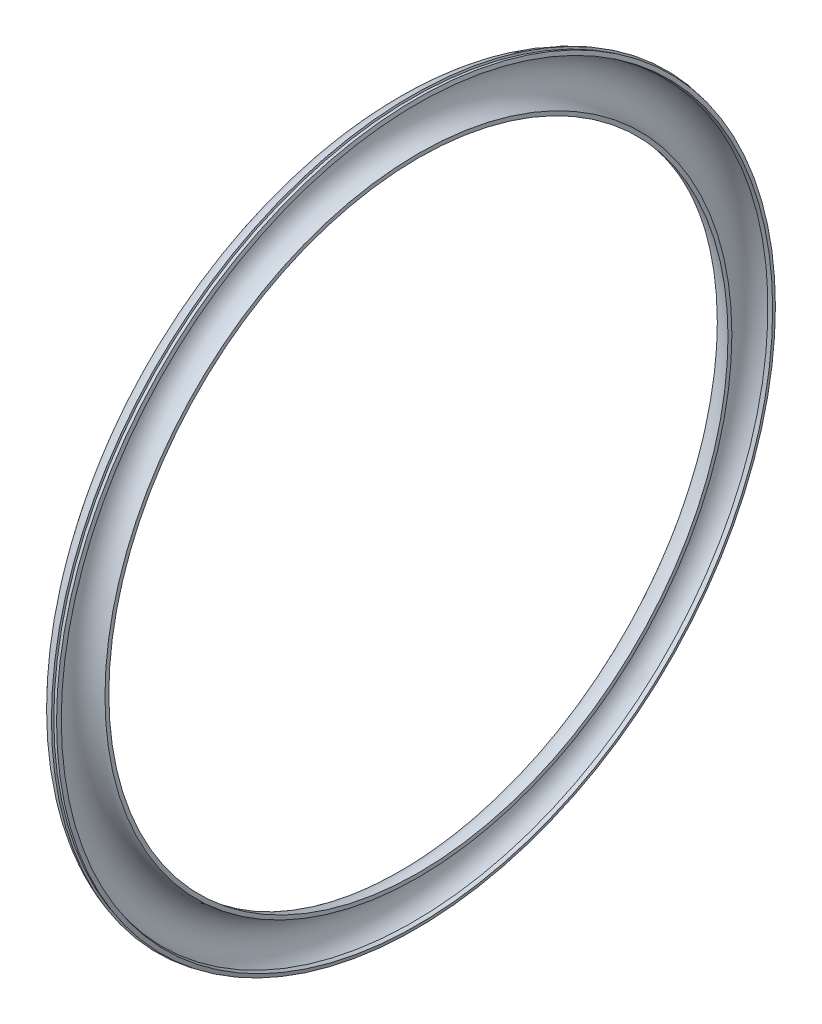
from build123d import *


with BuildPart() as part:
    # Sketch1 → Revolve1 (revolve)
    with BuildSketch(Plane.XY, mode=Mode.PRIVATE) as revolve1_sk:
        with BuildLine():
            Line((-4.788152334, 277.869627786), (-1.890374856, 278.646084922))
            Line((-1.890374856, 278.646084922), (-1.11391772, 275.748307443))
            Line((-1.11391772, 275.748307443), (-4.011695199, 274.971850307))
            Line((-4.011695199, 274.971850307), (-4.399923767, 276.420739047))
            ThreePointArc((-4.399923767, 276.420739047), (-16.854562643, 257.781054732), (0, 243))
            Line((0, 243), (0, 240))
            ThreePointArc((0, 240), (-19.828897227, 257.389476156), (-5.176380902, 279.318516526))
            Line((-5.176380902, 279.318516526), (-4.788152334, 277.869627786))
        make_face()
    revolve(revolve1_sk.sketch.rotate(Axis((-136.070817999, 0, 0), (1, 0, 0)), 90), axis=Axis((-136.070817999, 0, 0), (1, 0, 0)))


solid = part.part
